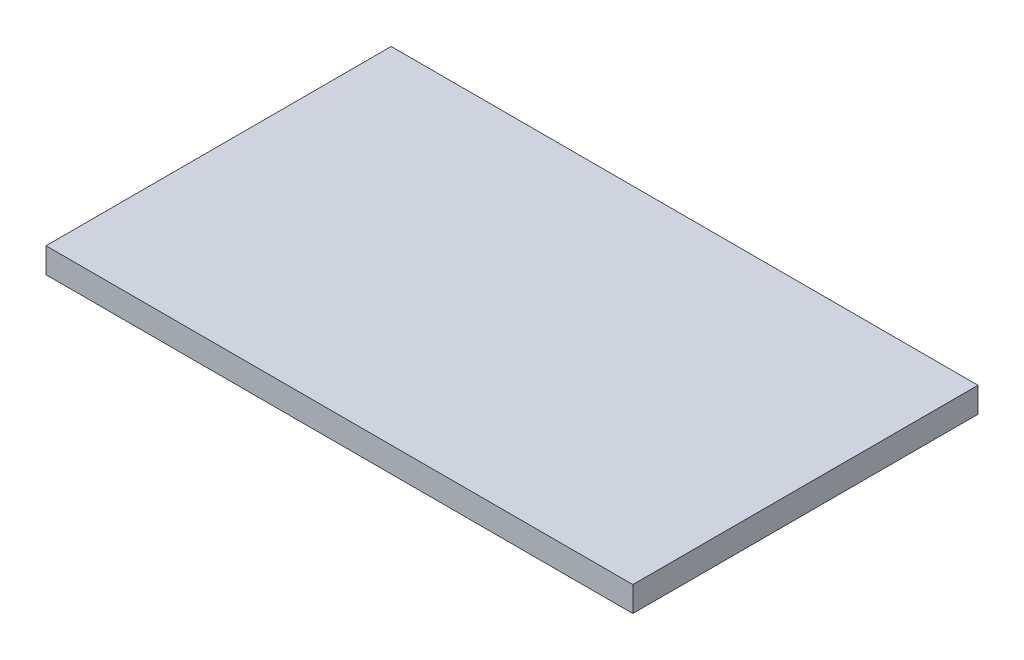
from build123d import *

# Parameters (mm, degrees)
SKETCH1_W           = 37.4
SKETCH1_H           = 22
BOSS_EXTRUDE1_DEPTH = 0.8


with BuildPart() as part:
    # Sketch1 → Boss-Extrude1 (new, symmetric)
    with BuildSketch(Plane(origin=(0, 0, 0), x_dir=(1, 0, 0), z_dir=(0, 1, 0))):
        Rectangle(SKETCH1_W, SKETCH1_H)
    extrude(amount=BOSS_EXTRUDE1_DEPTH, both=True)


solid = part.part
